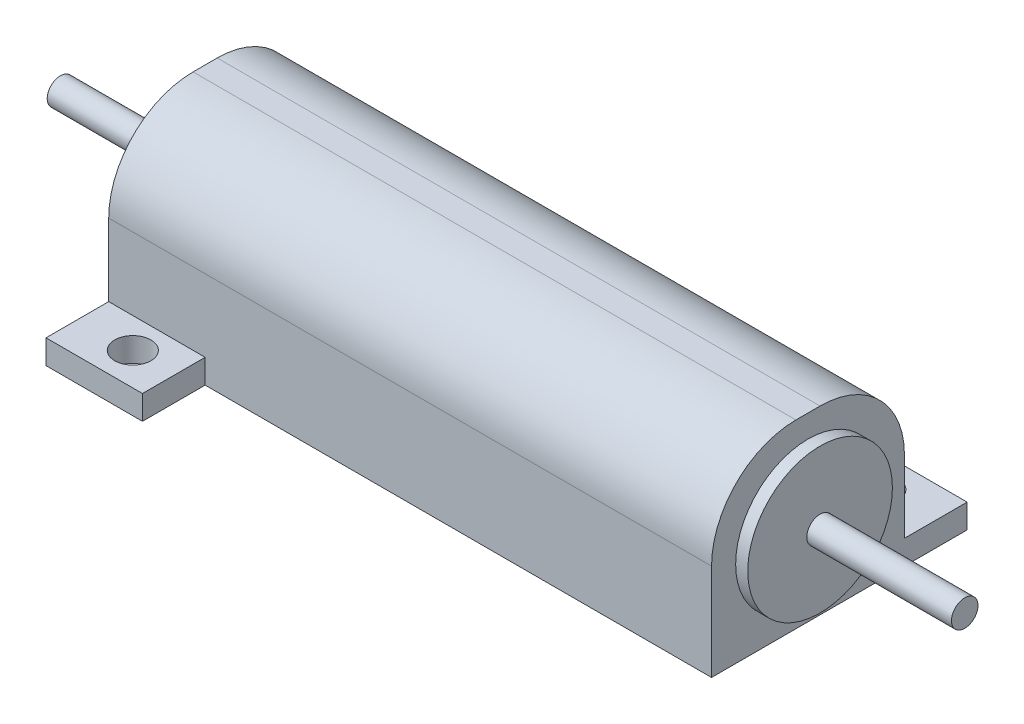
from build123d import *

# Parameters (mm, degrees)
SKETCH_1_W           = 50
SKETCH_1_H           = 16
EXTRUDE_1_DEPTH      = 15
SKETCH_2_W           = 8
SKETCH_2_H           = 5.2
SKETCH_2_R           = 1.5
EXTRUDE_2_DEPTH      = 2
FILLET_1_R           = 7
EXTRUDE_3_DEPTH      = 1
EXTRUDE_3_DEPTH_BACK = 51
SKETCH_3_R           = 6
EXTRUDE_4_DEPTH      = 12
EXTRUDE_4_DEPTH_BACK = 63
SKETCH_4_R           = 1.1


with BuildPart() as part:
    # Эскиз1 → Бобышка-Вытянуть1 (new body)
    with BuildSketch(Plane(origin=(0, 0, 0), x_dir=(1, 0, 0), z_dir=(0, 1, 0))):
        with Locations((25, -8)):
            Rectangle(SKETCH_1_W, SKETCH_1_H)
    extrude(amount=EXTRUDE_1_DEPTH)

    # Эскиз2 → Бобышка-Вытянуть2 (add)
    # profile 1 of 2: a face of its own
    with BuildSketch(Plane.XZ):
        with Locations((4, 18.6)):
            Rectangle(SKETCH_2_W, SKETCH_2_H)
        with Locations(Location((4.5, 18.5, 0), (0, 0, 270))):
            Circle(SKETCH_2_R, mode=Mode.SUBTRACT)
    # profile 2 of 2: a face of its own
    with BuildSketch(Plane.XZ):
        with Locations((46, -2.6)):
            Rectangle(SKETCH_2_W, SKETCH_2_H)
        with Locations(Location((45.5, -2.5, 0), (0, 0, 270))):
            Circle(SKETCH_2_R, mode=Mode.SUBTRACT)
    extrude(amount=-EXTRUDE_2_DEPTH)

    # Скругление1
    fillet_1_edges = [part.edges().sort_by_distance(p)[0] for p in [
        (25, 15, 0),
        (25, 15, 16),
    ]]
    fillet(fillet_1_edges, radius=FILLET_1_R)

    # Эскиз3 → Бобышка-Вытянуть3 (add, two sides: drawn at the far end of the back side and taken through both)
    with BuildSketch(Plane(origin=(50, 0, 0), x_dir=(0, 0, -1), z_dir=(1, 0, 0)).offset(-EXTRUDE_3_DEPTH_BACK)):
        with Locations((-8, 7.128166943)):
            Circle(SKETCH_3_R)
    extrude(amount=EXTRUDE_3_DEPTH + EXTRUDE_3_DEPTH_BACK)

    # Эскиз4 → Бобышка-Вытянуть4 (add, two sides: drawn at the far end of the back side and taken through both)
    with BuildSketch(Plane(origin=(51, 0, 0), x_dir=(0, 0, -1), z_dir=(1, 0, 0)).offset(-EXTRUDE_4_DEPTH_BACK)):
        with Locations((-8, 7.128166943)):
            Circle(SKETCH_4_R)
    extrude(amount=EXTRUDE_4_DEPTH + EXTRUDE_4_DEPTH_BACK)


solid = part.part
